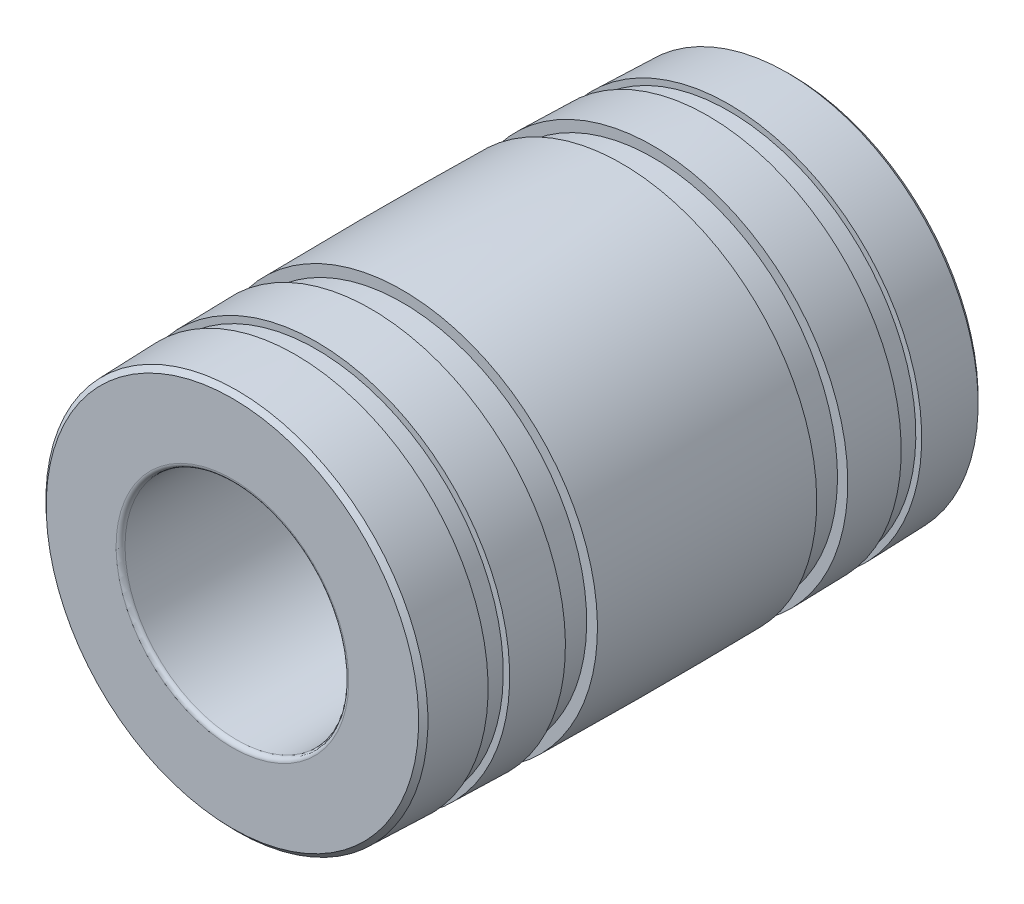
from build123d import *
from OCP.BRepFilletAPI import BRepFilletAPI_MakeChamfer

# Parameters (mm, degrees)
BORE_DEPTH       = 23.338105227
BORE_DEPTH_BACK  = 23.338105227
SKETCH2_R        = 6.35
OD_CHAMFER_SIZE  = 0.254
OD_CHAMFER_SIZE2 = 0.263376629
ID_FILLET_R      = 0.254


with BuildPart() as part:
    # Sketch1 → Bearing (revolve)
    with BuildSketch(Plane(origin=(0, 0, 0), x_dir=(0, 0, -1), z_dir=(1, 0, 0))):
        with BuildLine():
            Line((-15.875, 0), (15.875, 0))
            Line((15.875, 0), (15.875, -10.8346875))
            ThreePointArc((15.875, -10.8346875), (14.090759076, -10.893640768), (12.3063, -10.945573139))
            Line((12.3063, -10.945573139), (12.3063, -10.612198139))
            Line((12.3063, -10.612198139), (11.1125, -10.612198139))
            Line((11.1125, -10.612198139), (11.1125, -10.976393136))
            ThreePointArc((11.1125, -10.976393136), (9.563155787, -11.011704293), (8.0137, -11.041723127))
            Line((8.0137, -11.041723127), (8.0137, -10.458316877))
            Line((8.0137, -10.458316877), (6.223, -10.458316877))
            Line((6.223, -10.458316877), (6.223, -11.069821282))
            ThreePointArc((6.223, -11.069821282), (3.111573174, -11.101830195), (0, -11.1125))
            ThreePointArc((0, -11.1125), (-3.111573174, -11.101830195), (-6.223, -11.069821282))
            Line((-6.223, -11.069821282), (-6.223, -10.458316877))
            Line((-6.223, -10.458316877), (-8.0137, -10.458316877))
            Line((-8.0137, -10.458316877), (-8.0137, -11.041723127))
            ThreePointArc((-8.0137, -11.041723127), (-9.563155787, -11.011704293), (-11.1125, -10.976393136))
            Line((-11.1125, -10.976393136), (-11.1125, -10.612198139))
            Line((-11.1125, -10.612198139), (-12.3063, -10.612198139))
            Line((-12.3063, -10.612198139), (-12.3063, -10.945573139))
            ThreePointArc((-12.3063, -10.945573139), (-14.090759076, -10.893640768), (-15.875, -10.8346875))
            Line((-15.875, -10.8346875), (-15.875, 0))
        make_face()
    revolve(axis=Axis((0, 0, 15.875), (0, 0, -1)))

    # Sketch2 → Bore (cut, two sides: drawn at the far end of the back side and taken through both)
    with BuildSketch(Plane.XY.offset(-BORE_DEPTH_BACK)):
        Circle(SKETCH2_R)
    extrude(amount=BORE_DEPTH + BORE_DEPTH_BACK, mode=Mode.SUBTRACT)

    # OD Chamfer: one chamfer whose edges measure the first distance from different faces: ONE call of the kernel's chamfer builder (chamfer() names one face for all edges)
    od_chamfer_edges_1 = [part.edges().sort_by_distance(p)[0] for p in [
        (0, 10.8346875, 15.875),
    ]]
    od_chamfer_side_1 = [part.faces().sort_by_distance(p)[0] for p in [
        (0, 10.893640768, 14.090759076),
    ]]
    od_chamfer_edges_2 = [part.edges().sort_by_distance(p)[0] for p in [
        (0, 10.8346875, -15.875),
    ]]
    od_chamfer_side_2 = [part.faces().sort_by_distance(p)[0] for p in [
        (0, 10.52823626, -15.875),
    ]]
    od_chamfer = BRepFilletAPI_MakeChamfer(part.part.solid().wrapped)
    for e in od_chamfer_edges_1:
        od_chamfer.Add(OD_CHAMFER_SIZE, OD_CHAMFER_SIZE2, e.wrapped, od_chamfer_side_1[0].wrapped)  # the first distance lies on this face
    for e in od_chamfer_edges_2:
        od_chamfer.Add(OD_CHAMFER_SIZE, OD_CHAMFER_SIZE2, e.wrapped, od_chamfer_side_2[0].wrapped)  # the first distance lies on this face
    add(Compound.cast(od_chamfer.Shape()), mode=Mode.REPLACE)

    # ID Fillet
    id_fillet_edges = [part.edges().sort_by_distance(p)[0] for p in [
        (-6.35, 0, -15.875),
        (-6.35, 0, 15.875),
    ]]
    fillet(id_fillet_edges, radius=ID_FILLET_R)


solid = part.part
